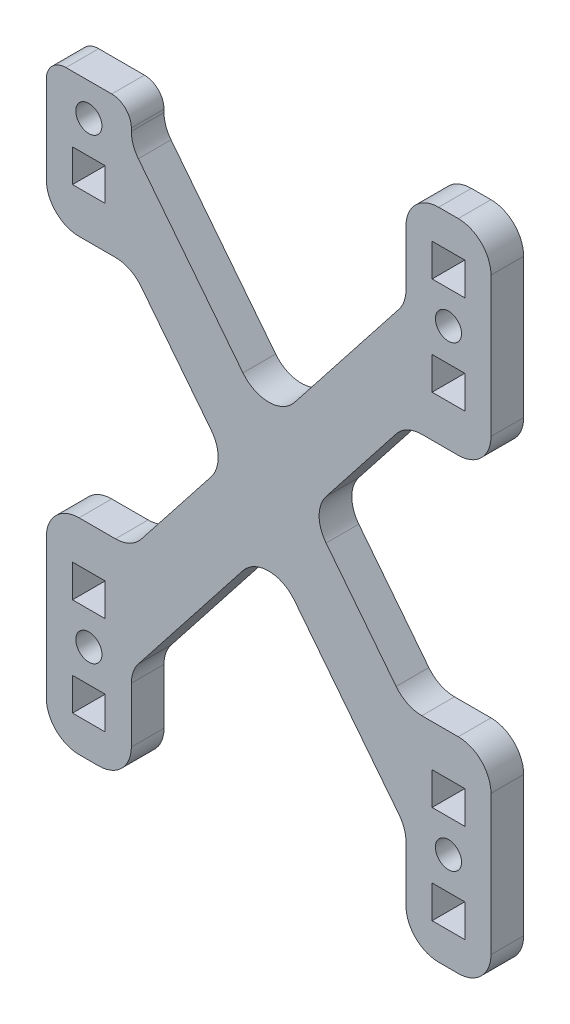
from build123d import *

# Parameters (mm, degrees)
ESQUISSE1_R             = 2
ESQUISSE1_W             = 5
ESQUISSE1_H             = 5
BOSS_EXTRU_1_DEPTH      = 5
CONG_1_R                = 5
ESQUISSE2_W             = 13
ESQUISSE2_H             = 10
ENL_V_MAT_EXTRU_1_DEPTH = 61.671245248
CONG_2_R                = 3


with BuildPart() as part:
    # Esquisse1 → Boss.-Extru.1 (new body)
    with BuildSketch(Plane.XY):
        Polygon((34, 50), (34, 18.634320993), (21, 18.634320993), (6.358747791, 0), (21, -18.634320993), (34, -18.634320993), (34, -50), (21, -50), (21, -34.820224461), (0, -8.092951734), (-21, -34.820224461), (-21, -50), (-34, -50), (-34, -18.634320993), (-21, -18.634320993), (-6.358747791, 0), (-21, 18.634320993), (-34, 18.634320993), (-34, 50), (-21, 50), (-21, 34.820224461), (0, 8.092951734), (21, 34.820224461), (21, 50), align=None)
        with Locations((27.5, 35)):
            Circle(ESQUISSE1_R, mode=Mode.SUBTRACT)
        with Locations(Location((-27.5, 35, 0), (0, 0, 180))):
            Circle(ESQUISSE1_R, mode=Mode.SUBTRACT)
        with Locations((-27.5, -35)):
            Circle(ESQUISSE1_R, mode=Mode.SUBTRACT)
        with Locations(Location((27.5, -35, 0), (0, 0, 90))):
            Circle(ESQUISSE1_R, mode=Mode.SUBTRACT)
        with Locations((27.5, 27.5)):
            Rectangle(ESQUISSE1_W, ESQUISSE1_H, mode=Mode.SUBTRACT)
        with Locations((27.5, 42.5)):
            Rectangle(ESQUISSE1_W, ESQUISSE1_H, mode=Mode.SUBTRACT)
        with Locations((-27.5, 27.5)):
            Rectangle(ESQUISSE1_W, ESQUISSE1_H, mode=Mode.SUBTRACT)
        with Locations((-27.5, 42.5)):
            Rectangle(ESQUISSE1_W, ESQUISSE1_H, mode=Mode.SUBTRACT)
        with Locations((-27.5, -27.5)):
            Rectangle(ESQUISSE1_W, ESQUISSE1_H, mode=Mode.SUBTRACT)
        with Locations((-27.5, -42.5)):
            Rectangle(ESQUISSE1_W, ESQUISSE1_H, mode=Mode.SUBTRACT)
        with Locations((27.5, -27.5)):
            Rectangle(ESQUISSE1_W, ESQUISSE1_H, mode=Mode.SUBTRACT)
        with Locations((27.5, -42.5)):
            Rectangle(ESQUISSE1_W, ESQUISSE1_H, mode=Mode.SUBTRACT)
    extrude(amount=BOSS_EXTRU_1_DEPTH)

    # Congé1
    cong_1_edges = [part.edges().sort_by_distance(p)[0] for p in [
        (34, 50, 2.5),
        (34, 18.634320993, 2.5),
        (21, 18.634320993, 2.5),
        (6.358747791, 0, 2.5),
        (21, -18.634320993, 2.5),
        (34, -18.634320993, 2.5),
        (34, -50, 2.5),
        (21, -50, 2.5),
        (21, -34.820224461, 2.5),
        (0, -8.092951734, 2.5),
        (-21, -34.820224461, 2.5),
        (-21, -50, 2.5),
        (-34, -50, 2.5),
        (-34, -18.634320993, 2.5),
        (-21, -18.634320993, 2.5),
        (-6.358747791, 0, 2.5),
        (-21, 18.634320993, 2.5),
        (-34, 18.634320993, 2.5),
        (-34, 50, 2.5),
        (-21, 50, 2.5),
        (-21, 34.820224461, 2.5),
        (0, 8.092951734, 2.5),
        (21, 34.820224461, 2.5),
        (21, 50, 2.5),
    ]]
    fillet(cong_1_edges, radius=CONG_1_R)

    # Esquisse2 → Enlèv. mat.-Extru.1 (cut, through all)
    with BuildSketch(Plane.XY.offset(5)):
        with Locations((-27.5, 45)):
            Rectangle(ESQUISSE2_W, ESQUISSE2_H)
    extrude(amount=-ENL_V_MAT_EXTRU_1_DEPTH, mode=Mode.SUBTRACT)

    # Congé2
    cong_2_edges = [part.edges().sort_by_distance(p)[0] for p in [
        (-21, 40, 2.5),
        (-34, 40, 2.5),
    ]]
    fillet(cong_2_edges, radius=CONG_2_R)


solid = part.part
